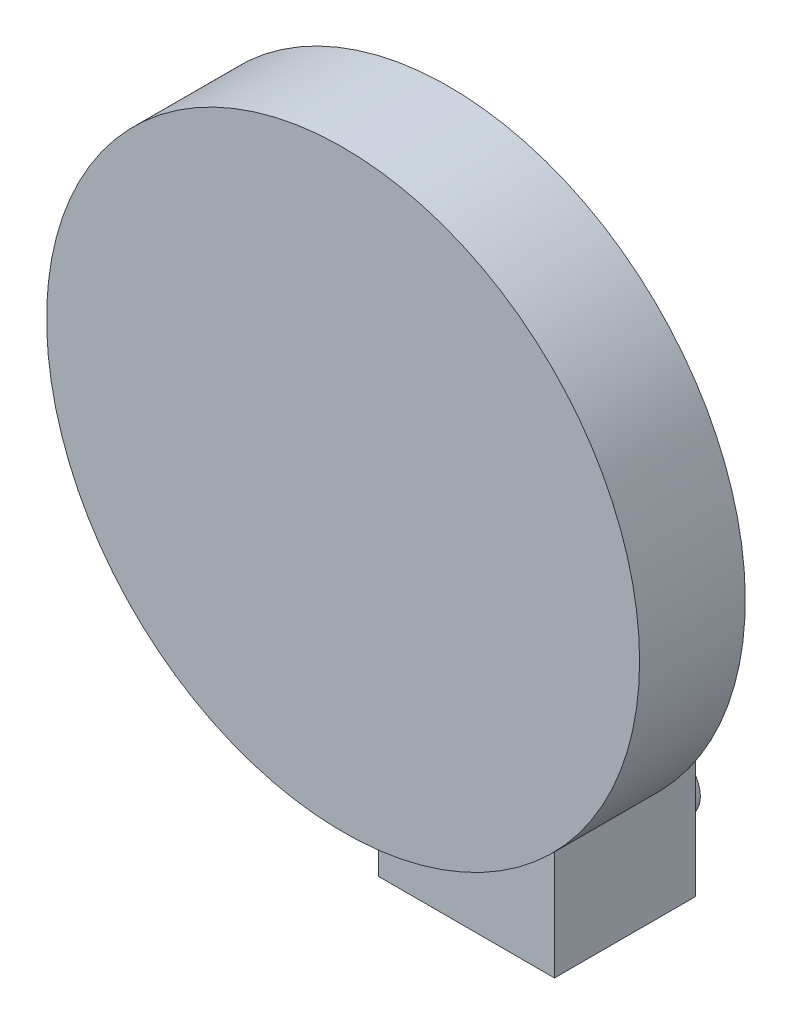
from build123d import *

# Parameters (mm, degrees)
SKETCH1_R           = 42.075
BOSS_EXTRUDE1_DEPTH = 15
BOSS_EXTRUDE3_DEPTH = 20
SKETCH10_R          = 4
BOSS_EXTRUDE8_DEPTH = 8


with BuildPart() as part:
    # Sketch1 → Boss-Extrude1 (new body)
    with BuildSketch(Plane.XY):
        Circle(SKETCH1_R)
    extrude(amount=BOSS_EXTRUDE1_DEPTH)

    # Sketch4 → Boss-Extrude3 (add)
    with BuildSketch(Plane(origin=(0, 0, 0), x_dir=(-1, 0, 0), z_dir=(0, 0, -1))):
        Polygon((10, 0), (0, 0), (-15, 0), (-15, -60), (10, -60), align=None)
    extrude(amount=BOSS_EXTRUDE3_DEPTH)

    # Sketch10 → Boss-Extrude8 (add)
    with BuildSketch(Plane(origin=(0, 0, -20), x_dir=(-1, 0, 0), z_dir=(0, 0, -1))):
        with Locations((-3.69323872, -55.331161555)):
            Circle(SKETCH10_R)
    extrude(amount=BOSS_EXTRUDE8_DEPTH)


solid = part.part
